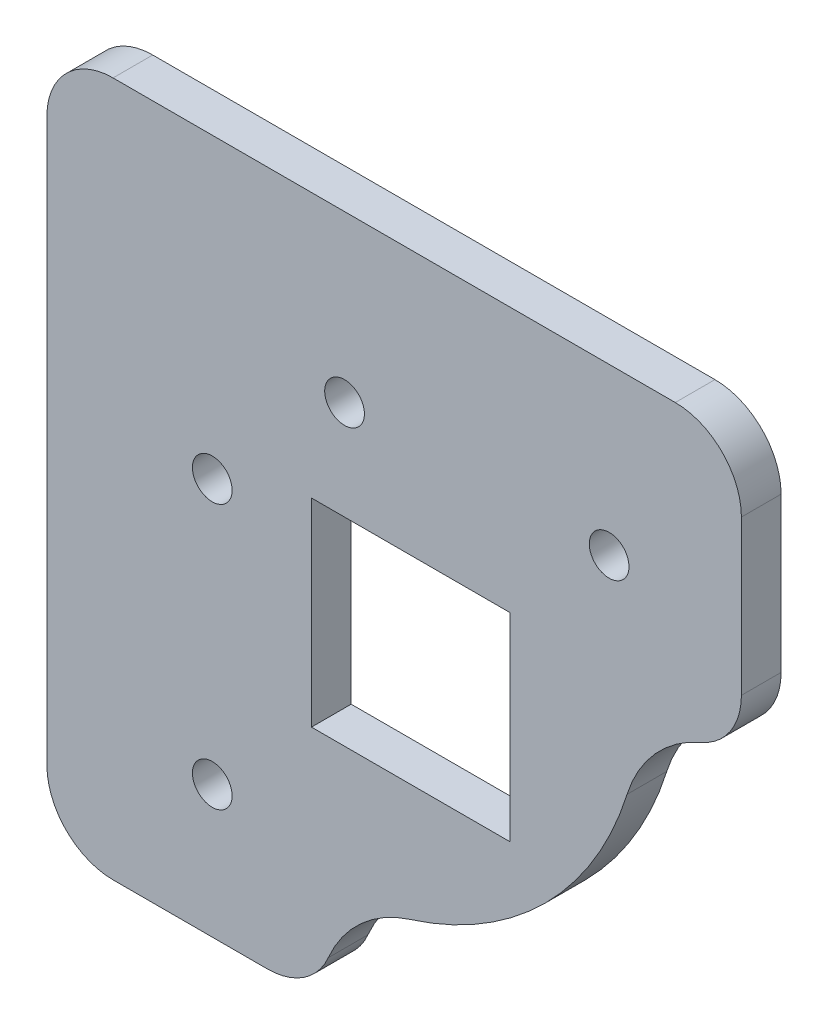
from build123d import *

# Parameters (mm, degrees)
SKETCH_1_R      = 1.5
SKETCH_1_W      = 15
SKETCH_1_H      = 15
EXTRUDE_1_DEPTH = 3
FILLET_1_R      = 5


with BuildPart() as part:
    # 草图1 → 凸台-拉伸1 (new body)
    with BuildSketch(Plane.XY):
        with BuildLine():
            Line((0, 0), (52.5, 0))
            Line((52.5, 0), (52.5, -20.5))
            ThreePointArc((52.5, -20.5), (47.122398776, -22.675796862), (43.857589438, -27.47097224))
            ThreePointArc((43.857589438, -27.47097224), (37.67766953, -37.67766953), (27.47097224, -43.857589438))
            ThreePointArc((27.47097224, -43.857589438), (22.675796862, -47.122398776), (20.5, -52.5))
            Line((20.5, -52.5), (0, -52.5))
            Line((0, -52.5), (0, 0))
        make_face()
        with Locations((22.5, -12.5)):
            Circle(SKETCH_1_R, mode=Mode.SUBTRACT)
        with Locations((42.5, -12.5)):
            Circle(SKETCH_1_R, mode=Mode.SUBTRACT)
        with Locations(Location((12.5, -42.5, 0), (0, 0, 180))):
            Circle(SKETCH_1_R, mode=Mode.SUBTRACT)
        with Locations(Location((12.5, -22.5, 0), (0, 0, 180))):
            Circle(SKETCH_1_R, mode=Mode.SUBTRACT)
        with Locations((27.5, -27.5)):
            Rectangle(SKETCH_1_W, SKETCH_1_H, mode=Mode.SUBTRACT)
    extrude(amount=EXTRUDE_1_DEPTH)

    # 圆角1
    fillet_1_edges = [part.edges().sort_by_distance(p)[0] for p in [
        (0, 0, 1.5),
        (52.5, 0, 1.5),
        (52.5, -20.5, 1.5),
        (20.5, -52.5, 1.5),
        (0, -52.5, 1.5),
    ]]
    fillet(fillet_1_edges, radius=FILLET_1_R)


solid = part.part
